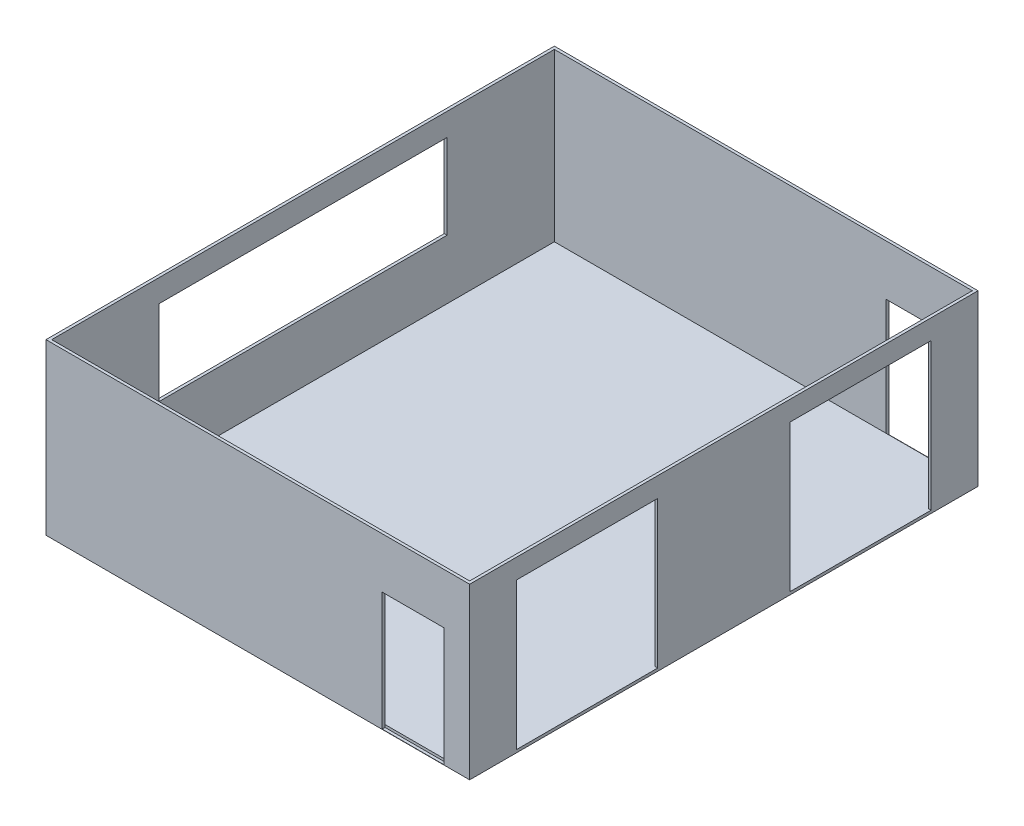
from build123d import *

# Parameters (mm, degrees)
SKETCH1_W           = 7500
SKETCH1_H           = 9000
BOSS_EXTRUDE1_DEPTH = 3000
SHELL1_T            = -50
CUT_EXTRUDE2_REACH  = 9248.621
SKETCH2_W           = 2500
SKETCH2_H           = 2600
SKETCH3_W           = 2500
SKETCH3_H           = 2600
CUT_EXTRUDE3_DEPTH  = 3000
SKETCH4_W           = 1100
SKETCH4_H           = 2100
CUT_EXTRUDE4_DEPTH  = 50
SKETCH6_W           = 1100
SKETCH6_H           = 2100
CUT_EXTRUDE5_DEPTH  = 50
SKETCH7_W           = 5100
SKETCH7_H           = 1500
CUT_EXTRUDE6_DEPTH  = 50


with BuildPart() as part:
    # Sketch1 → Boss-Extrude1 (new body)
    with BuildSketch(Plane(origin=(0, 0, 0), x_dir=(1, 0, 0), z_dir=(0, 1, 0))):
        Rectangle(SKETCH1_W, SKETCH1_H)
    extrude(amount=BOSS_EXTRUDE1_DEPTH)

    # Shell1
    shell1_openings = [part.faces().sort_by_distance(p)[0] for p in [
        (0, 3000, 0),
    ]]
    offset(amount=SHELL1_T, openings=shell1_openings, kind=Kind.INTERSECTION)

    # Sketch2 → Cut-Extrude2 (cut, up to next)
    with BuildSketch(Plane(origin=(3750, 0, 0), x_dir=(0, 0, -1), z_dir=(1, 0, 0)), mode=Mode.PRIVATE) as cut_extrude2_sk1:
        with Locations((2420, 1350)):
            Rectangle(SKETCH2_W, SKETCH2_H)
    cut_extrude2_tool1 = extrude(cut_extrude2_sk1.sketch, amount=-CUT_EXTRUDE2_REACH, mode=Mode.PRIVATE) & part.part
    add(cut_extrude2_tool1.solids().sort_by_distance((3750, 1350, -2420))[0], mode=Mode.SUBTRACT)

    # Sketch3 → Cut-Extrude3 (cut)
    with BuildSketch(Plane(origin=(3750, 0, 0), x_dir=(0, 0, -1), z_dir=(1, 0, 0))):
        with Locations((-2420, 1350)):
            Rectangle(SKETCH3_W, SKETCH3_H)
    extrude(amount=-CUT_EXTRUDE3_DEPTH, mode=Mode.SUBTRACT)

    # Sketch4 → Cut-Extrude4 (cut)
    with BuildSketch(Plane.XY.offset(4500)):
        with Locations((2750, 1055)):
            Rectangle(SKETCH4_W, SKETCH4_H)
    extrude(amount=-CUT_EXTRUDE4_DEPTH, mode=Mode.SUBTRACT)

    # Sketch6 → Cut-Extrude5 (cut)
    with BuildSketch(Plane(origin=(0, 0, -4500), x_dir=(-1, 0, 0), z_dir=(0, 0, -1))):
        with Locations((-2720, 1055)):
            Rectangle(SKETCH6_W, SKETCH6_H)
    extrude(amount=-CUT_EXTRUDE5_DEPTH, mode=Mode.SUBTRACT)

    # Sketch7 → Cut-Extrude6 (cut)
    with BuildSketch(Plane.ZY.offset(3750)):
        with Locations((0, 1850)):
            Rectangle(SKETCH7_W, SKETCH7_H)
    extrude(amount=-CUT_EXTRUDE6_DEPTH, mode=Mode.SUBTRACT)


solid = part.part
